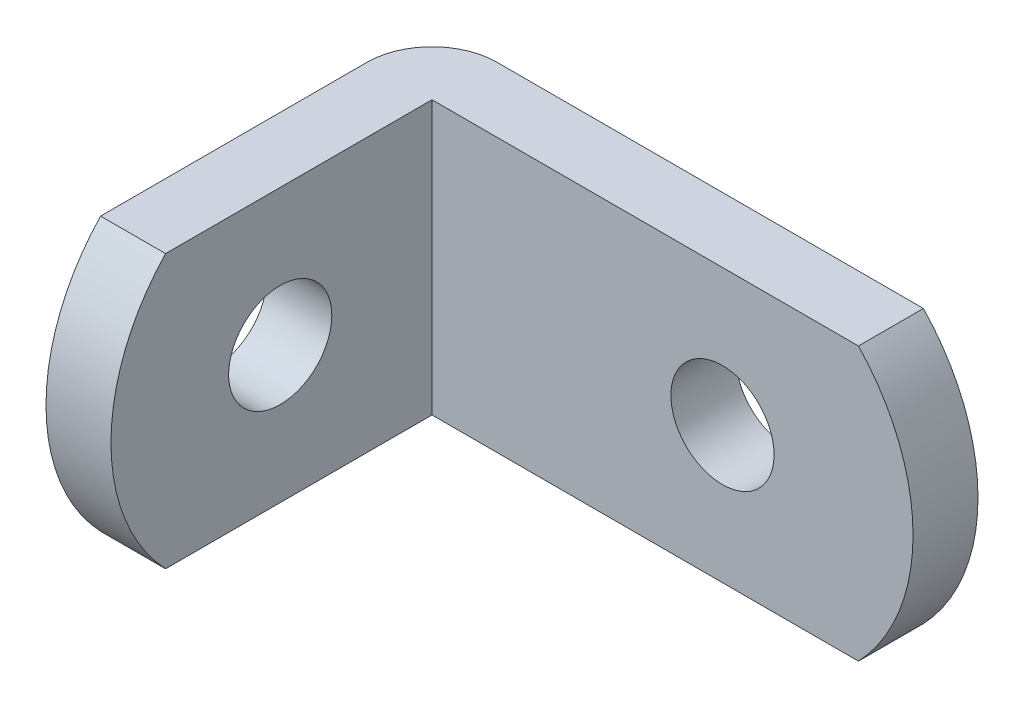
from build123d import *

# Parameters (mm, degrees)
EXTRUDE_THIN1_DEPTH     = 6.35
CUT_EXTRUDE1_DEPTH      = 30.386274204
CUT_EXTRUDE1_DEPTH_BACK = 30.386274204
SKETCH7_R               = 2.4
CUT_EXTRUDE3_DEPTH      = 30.386274204
CUT_EXTRUDE2_DEPTH      = 31.142042052
CUT_EXTRUDE2_DEPTH_BACK = 31.142042052
SKETCH8_R               = 2.4
CUT_EXTRUDE4_DEPTH      = 31.142042052


with BuildPart() as part:
    # Sketch4 → Extrude-Thin1 (new, symmetric)
    with BuildSketch(Plane(origin=(0, 0, 0), x_dir=(1, 0, 0), z_dir=(0, 1, 0))):
        with BuildLine():
            Line((25.4, 0), (3.0226, 0))
            ThreePointArc((3.0226, 0), (0.885299043, -0.885299043), (0, -3.0226))
            Line((0, -3.0226), (0, -17.9578))
            Line((0, -17.9578), (3.0226, -17.9578))
            Line((3.0226, -17.9578), (3.0226, -3.0226))
            Line((3.0226, -3.0226), (25.4, -3.0226))
            Line((25.4, -3.0226), (25.4, 0))
        make_face()
    extrude(amount=EXTRUDE_THIN1_DEPTH, both=True)

    # Sketch5 → Cut-Extrude1 (cut, two sides: drawn at the far end of the back side and taken through both)
    with BuildSketch(Plane(origin=(3.0226, 0, 0), x_dir=(0, 0, -1), z_dir=(1, 0, 0)).offset(-CUT_EXTRUDE1_DEPTH_BACK)):
        with BuildLine():
            Line((19.030404457, 42.52061468), (-15.4178, 6.35))
            ThreePointArc((-15.4178, 6.35), (-17.9578, 0), (-15.4178, -6.35))
            Line((-15.4178, -6.35), (19.030404457, -42.52061468))
            Line((19.030404457, -42.52061468), (-80.869388468, -42.52061468))
            Line((-80.869388468, -42.52061468), (-80.869388468, 42.52061468))
            Line((-80.869388468, 42.52061468), (19.030404457, 42.52061468))
        make_face()
    extrude(amount=CUT_EXTRUDE1_DEPTH + CUT_EXTRUDE1_DEPTH_BACK, mode=Mode.SUBTRACT)

    # Sketch7 → Cut-Extrude3 (cut, through all)
    with BuildSketch(Plane(origin=(3.0226, 0, 0), x_dir=(0, 0, -1), z_dir=(1, 0, 0))):
        with Locations((-10.0838, 0)):
            Circle(SKETCH7_R)
    extrude(amount=-CUT_EXTRUDE3_DEPTH, mode=Mode.SUBTRACT)

    # Sketch6 → Cut-Extrude2 (cut, two sides: drawn at the far end of the back side and taken through both)
    with BuildSketch(Plane.XY.offset(3.0226).offset(-CUT_EXTRUDE2_DEPTH_BACK)):
        with BuildLine():
            Line((-20.10675939, -51.46509736), (22.86, -6.35))
            ThreePointArc((22.86, -6.35), (25.4, 0), (22.86, 6.35))
            Line((22.86, 6.35), (-20.10675939, 51.46509736))
            Line((-20.10675939, 51.46509736), (104.496842842, 51.46509736))
            Line((104.496842842, 51.46509736), (104.496842842, -51.46509736))
            Line((104.496842842, -51.46509736), (-20.10675939, -51.46509736))
        make_face()
    extrude(amount=CUT_EXTRUDE2_DEPTH + CUT_EXTRUDE2_DEPTH_BACK, mode=Mode.SUBTRACT)

    # Sketch8 → Cut-Extrude4 (cut, through all)
    with BuildSketch(Plane.XY.offset(3.0226)):
        with Locations((16.5354, 0)):
            Circle(SKETCH8_R)
    extrude(amount=-CUT_EXTRUDE4_DEPTH, mode=Mode.SUBTRACT)


solid = part.part
